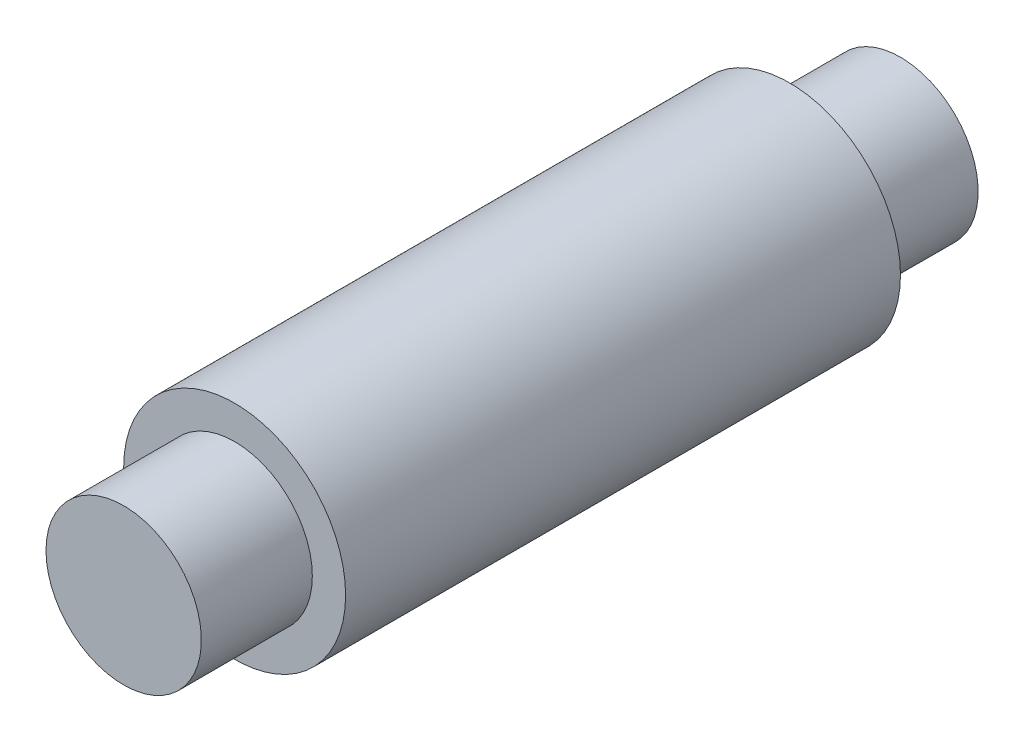
from build123d import *

# Parameters (mm, degrees)
SKETCH_1_R           = 2
SKETCH_1_R_2         = 1.4
EXTRUDE_1_DEPTH      = 10
SKETCH_2_R           = 1.4
EXTRUDE_2_DEPTH      = 10
EXTRUDE_3_DEPTH      = 2
EXTRUDE_3_DEPTH_BACK = 12
SKETCH_3_R           = 1.4


with BuildPart() as part:
    # 草图1 → 凸台-拉伸1 (new body)
    with BuildSketch(Plane.XY):
        Circle(SKETCH_1_R)
        Circle(SKETCH_1_R_2, mode=Mode.SUBTRACT)
    extrude(amount=EXTRUDE_1_DEPTH)

    # 草图2 → 凸台-拉伸2 (add)
    with BuildSketch(Plane(origin=(0, 0, 0), x_dir=(-1, 0, 0), z_dir=(0, 0, -1))):
        Circle(SKETCH_2_R)
    extrude(amount=-EXTRUDE_2_DEPTH)

    # 草图3 → 凸台-拉伸3 (add, two sides: drawn at the far end of the back side and taken through both)
    with BuildSketch(Plane(origin=(0, 0, 0), x_dir=(-1, 0, 0), z_dir=(0, 0, -1)).offset(-EXTRUDE_3_DEPTH_BACK)):
        Circle(SKETCH_3_R)
    extrude(amount=EXTRUDE_3_DEPTH + EXTRUDE_3_DEPTH_BACK)


solid = part.part
